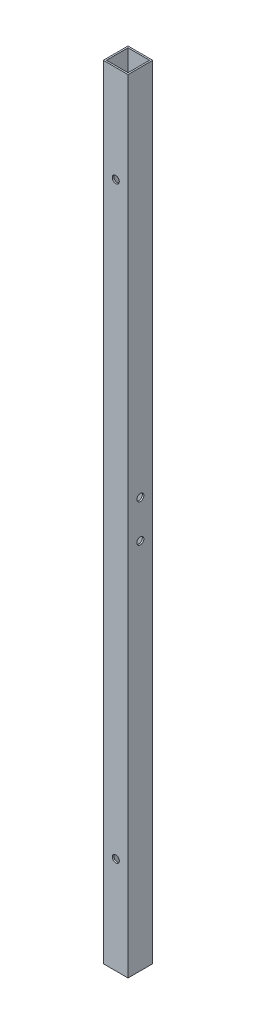
from build123d import *

# Parameters (mm, degrees)
SKETCH1_W           = 15.8
SKETCH1_H           = 15.8
SKETCH1_W_2         = 13.8
SKETCH1_H_2         = 13.8
BOSS_EXTRUDE2_DEPTH = 500
SKETCH4_R           = 2.25
CUT_EXTRUDE2_DEPTH  = 501.311952686
SKETCH6_R           = 2.25
CUT_EXTRUDE3_DEPTH  = 501.311952686


with BuildPart() as part:
    # Sketch1 → Boss-Extrude2 (new body)
    with BuildSketch(Plane(origin=(0, 0, 0), x_dir=(1, 0, 0), z_dir=(0, 1, 0))):
        Rectangle(SKETCH1_W, SKETCH1_H)
        Rectangle(SKETCH1_W_2, SKETCH1_H_2, mode=Mode.SUBTRACT)
    extrude(amount=BOSS_EXTRUDE2_DEPTH)

    # Sketch4 → Cut-Extrude2 (cut, through all)
    with BuildSketch(Plane(origin=(0, 0, -7.9), x_dir=(-1, 0, 0), z_dir=(0, 0, -1))):
        with Locations(Location((-0.094266251, 438, 0), (0, 0, 180))):
            Circle(SKETCH4_R)
        with Locations((-0.094266251, 62)):
            Circle(SKETCH4_R)
    extrude(amount=-CUT_EXTRUDE2_DEPTH, mode=Mode.SUBTRACT)

    # Sketch6 → Cut-Extrude3 (cut, through all)
    with BuildSketch(Plane(origin=(7.9, 0, 0), x_dir=(0, 0, -1), z_dir=(1, 0, 0))):
        with Locations((0, 262)):
            Circle(SKETCH6_R)
        with Locations((0, 238)):
            Circle(SKETCH6_R)
    extrude(amount=-CUT_EXTRUDE3_DEPTH, mode=Mode.SUBTRACT)


solid = part.part
